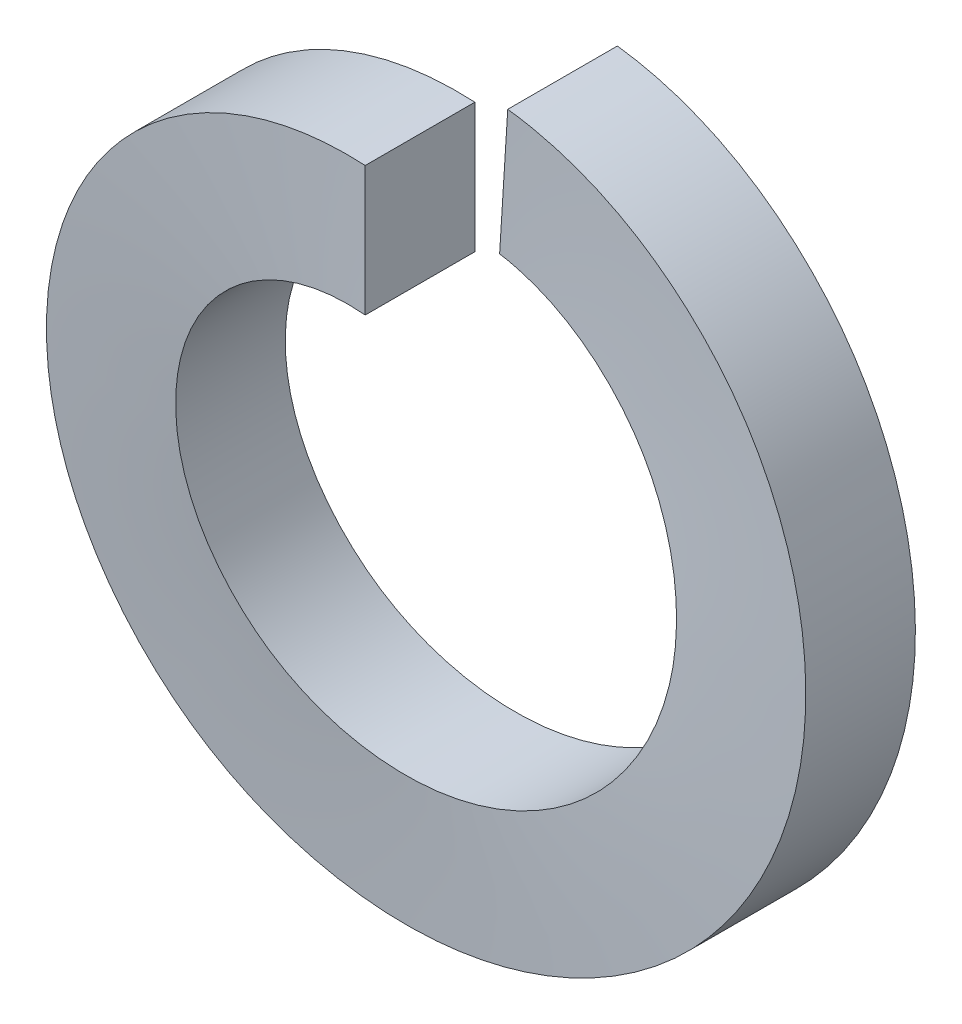
from build123d import *

# Parameters (mm, degrees)
SWEEP1_PITCH       = 1.222222222
SWEEP1_HEIGHT      = 1.21
SWEEP1_RADIUS      = 3.5
SWEEP1_START_ANGLE = 90
SKETCH2_W          = 1.1
SKETCH2_H          = 1.3


with BuildPart() as part:
    # Sweep1: sweep along a helix
    with BuildLine() as sweep1_path:
        add(Helix(SWEEP1_PITCH, SWEEP1_HEIGHT, SWEEP1_RADIUS, center=(0, 0, 0), direction=(0, 0, -1), lefthand=True, mode=Mode.PRIVATE).rotate(Axis((0, 0, 0), (0, 0, -1)), SWEEP1_START_ANGLE))
    # Sketch2 → Sweep1 (sweep)
    with BuildSketch(Plane(origin=(0, 0, 0), x_dir=(0, 0, -1), z_dir=(1, 0, 0))):
        with Locations((-0.55, 2.85)):
            Rectangle(SKETCH2_W, SKETCH2_H)
    sweep(path=sweep1_path.line, is_frenet=True)


solid = part.part
